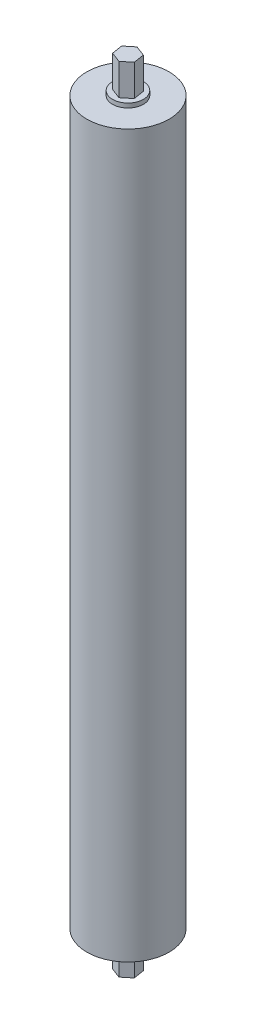
from build123d import *

# Parameters (mm, degrees)
SKETCH1_R           = 24.0411
BOSS_EXTRUDE1_DEPTH = 211.0105
SKETCH2_R           = 9.017
BOSS_EXTRUDE2_DEPTH = 2.54
BOSS_EXTRUDE3_DEPTH = 18.415


with BuildPart() as part:
    # Sketch1 → Boss-Extrude1 (new body)
    with BuildSketch(Plane(origin=(0, 0, 0), x_dir=(1, 0, 0), z_dir=(0, 1, 0))):
        with Locations(Location((0, 0, 0), (0, 0, 270))):
            Circle(SKETCH1_R)
    boss_extrude1 = extrude(amount=BOSS_EXTRUDE1_DEPTH)

    # Sketch2 → Boss-Extrude2 (add)
    with BuildSketch(Plane(origin=(0, 211.0105, 0), x_dir=(1, 0, 0), z_dir=(0, 1, 0))):
        with Locations(Location((0, 0, 0), (0, 0, 270))):
            Circle(SKETCH2_R)
    boss_extrude2 = extrude(amount=BOSS_EXTRUDE2_DEPTH)

    # Sketch3 → Boss-Extrude3 (add)
    with BuildSketch(Plane(origin=(0, 213.5505, 0), x_dir=(1, 0, 0), z_dir=(0, 1, 0))):
        Polygon((5.963677607, -2.264512398), (4.942964068, 4.032440108), (-1.020713539, 6.296952507), (-5.963677607, 2.264512398), (-4.942964068, -4.032440108), (1.020713539, -6.296952507), align=None)
    boss_extrude3 = extrude(amount=BOSS_EXTRUDE3_DEPTH)

    # Mirror1: Boss-Extrude1, Boss-Extrude2, Boss-Extrude3 across plane
    add(boss_extrude1.mirror(Plane.ZX))
    add(boss_extrude2.mirror(Plane.ZX))
    add(boss_extrude3.mirror(Plane.ZX))


solid = part.part
